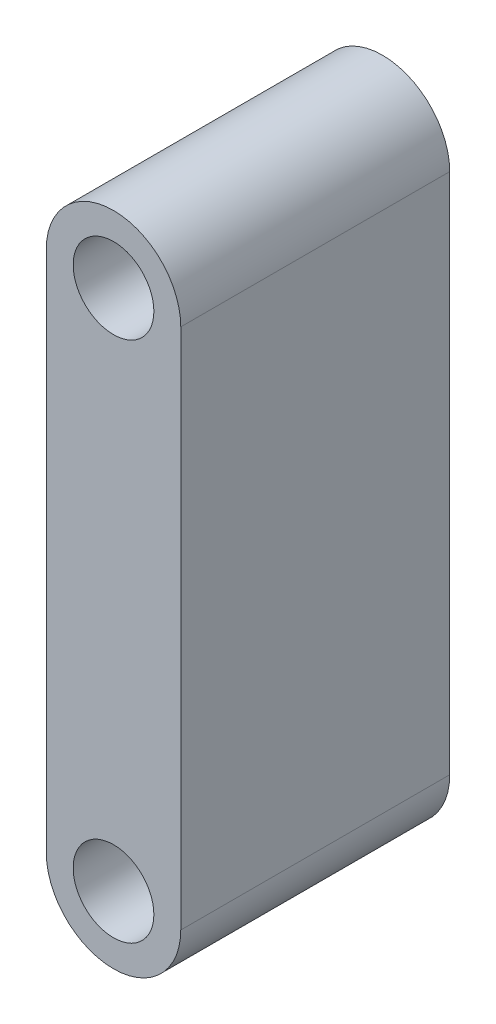
from build123d import *

# Parameters (mm, degrees)
SCHIZZO2_R                   = 15
ESTRUSIONE_ESTRUSIONE1_DEPTH = 50


with BuildPart() as part:
    # Schizzo2 → Estrusione-Estrusione1 (new, symmetric)
    with BuildSketch(Plane.XY):
        with BuildLine():
            Line((25, 154.556382451), (25, -39.643617549))
            ThreePointArc((25, -39.643617549), (0, -64.643617549), (-25, -39.643617549))
            Line((-25, -39.643617549), (-25, 154.556382451))
            ThreePointArc((-25, 154.556382451), (0, 179.556382451), (25, 154.556382451))
        make_face()
        with Locations((0, 154.556382451)):
            Circle(SCHIZZO2_R, mode=Mode.SUBTRACT)
        with Locations((0, -39.643617549)):
            Circle(SCHIZZO2_R, mode=Mode.SUBTRACT)
    extrude(amount=ESTRUSIONE_ESTRUSIONE1_DEPTH, both=True)


solid = part.part
